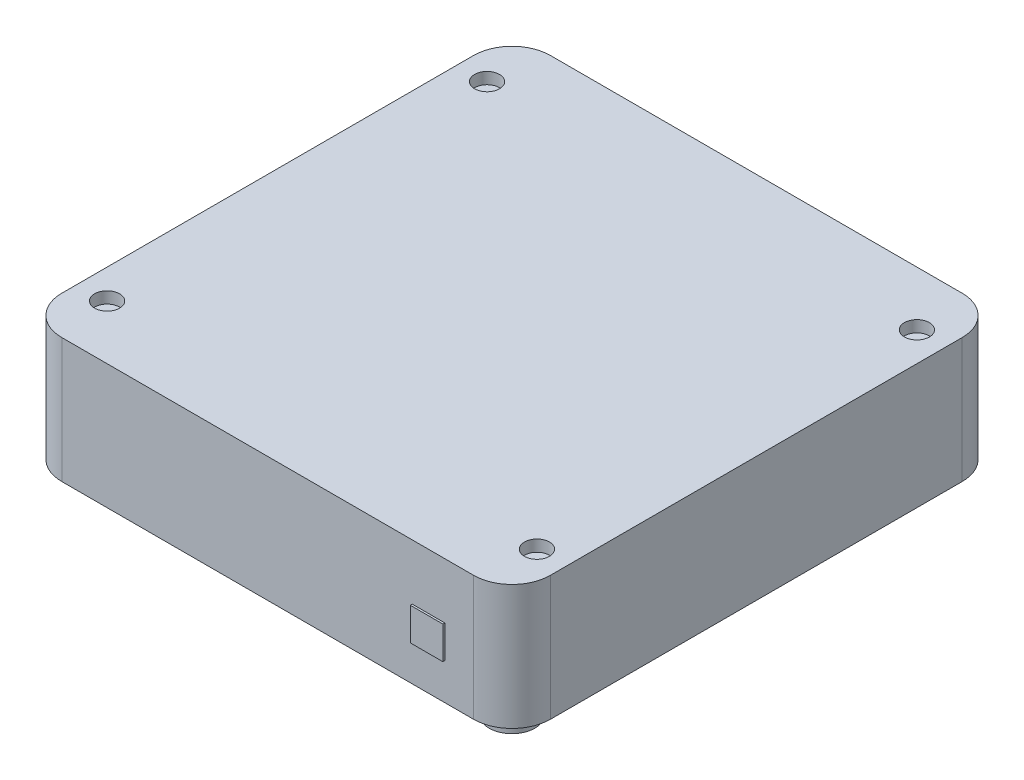
from build123d import *

# Parameters (mm, degrees)
SKETCH_1_W               = 127.3
SKETCH_1_H               = 127.3
EXTRUDE_1_DEPTH          = 16.25
SKETCH_2_W               = 8.5
SKETCH_2_H               = 8.5
EXTRUDE_2_DEPTH          = 0.5
SKETCH_3_R               = 6
EXTRUDE_3_DEPTH          = 6
MIRROR_2_COPY_1_SKETCH_R = 6
MIRROR_2_COPY_1_DEPTH    = 6
SKETCH_4_R               = 3.25
CUT_EXTRUDE_1_DEPTH      = 3
MIRROR_4_COPY_1_SKETCH_R = 3.25
MIRROR_4_COPY_1_DEPTH    = 3
FILLET_1_R               = 10
SKETCH_5_R               = 1.6
CUT_EXTRUDE_2_DEPTH      = 3


with BuildPart() as part:
    # 草图1 → 凸台-拉伸1 (new, symmetric)
    with BuildSketch(Plane(origin=(0, 0, 0), x_dir=(1, 0, 0), z_dir=(0, 1, 0))):
        Rectangle(SKETCH_1_W, SKETCH_1_H)
    extrude(amount=EXTRUDE_1_DEPTH, both=True)

    # 草图2 → 凸台-拉伸2 (add, symmetric)
    with BuildSketch(Plane.XY.offset(63.65)):
        with Locations((41.9, -2.5)):
            Rectangle(SKETCH_2_W, SKETCH_2_H)
    extrude(amount=EXTRUDE_2_DEPTH, both=True)

    # 草图3 → 凸台-拉伸3 (add)
    with BuildSketch(Plane.XZ.offset(16.25)):
        with Locations(Location((51.65, 51.65, 0), (0, 0, 90))):
            Circle(SKETCH_3_R)
    extrude_3 = extrude(amount=EXTRUDE_3_DEPTH)

    # 镜向1: 凸台-拉伸3 across plane
    add(extrude_3.mirror(Plane.XY))

    # 镜向2: 凸台-拉伸3 across plane
    add(extrude_3.mirror(Plane(origin=(0, 0, 0), x_dir=(0, 0, 1), z_dir=(1, 0, 0))))

    # 镜向2 copy 1 sketch → 镜向2 copy 1 (add)
    with BuildSketch(Plane(origin=(0, -16.25, 0), x_dir=(-1, 0, 0), z_dir=(0, -1, 0))):
        with Locations(Location((51.65, 51.65, 0), (0, 0, 90))):
            Circle(MIRROR_2_COPY_1_SKETCH_R)
    extrude(amount=MIRROR_2_COPY_1_DEPTH)

    # 草图4 → 切除-拉伸1 (cut)
    with BuildSketch(Plane(origin=(0, 16.25, 0), x_dir=(1, 0, 0), z_dir=(0, 1, 0))):
        with Locations(Location((56, 49.5, 0), (0, 0, 270))):
            Circle(SKETCH_4_R)
    cut_extrude_1 = extrude(amount=-CUT_EXTRUDE_1_DEPTH, mode=Mode.SUBTRACT)

    # 镜向3: 切除-拉伸1 across plane
    add(cut_extrude_1.mirror(Plane(origin=(0, 0, 0), x_dir=(0, 0, 1), z_dir=(1, 0, 0))), mode=Mode.SUBTRACT)

    # 镜向4: 切除-拉伸1 across plane
    add(cut_extrude_1.mirror(Plane.XY), mode=Mode.SUBTRACT)

    # 镜向4 copy 1 sketch → 镜向4 copy 1 (cut)
    with BuildSketch(Plane(origin=(0, 16.25, 0), x_dir=(-1, 0, 0), z_dir=(0, 1, 0))):
        with Locations(Location((56, 49.5, 0), (0, 0, 270))):
            Circle(MIRROR_4_COPY_1_SKETCH_R)
    extrude(amount=-MIRROR_4_COPY_1_DEPTH, mode=Mode.SUBTRACT)

    # 圆角1
    fillet_1_edges = [part.edges().sort_by_distance(p)[0] for p in [
        (63.65, 0, 63.65),
        (-63.65, 0, 63.65),
        (-63.65, 0, -63.65),
        (63.65, 0, -63.65),
    ]]
    fillet(fillet_1_edges, radius=FILLET_1_R)

    # 草图5 → 切除-拉伸2 (cut)
    with BuildSketch(Plane.XZ.offset(16.25)):
        with Locations(Location((-48, 0, 0), (0, 0, 270))):
            Circle(SKETCH_5_R)
        with Locations(Location((48, 0, 0), (0, 0, 270))):
            Circle(SKETCH_5_R)
    extrude(amount=-CUT_EXTRUDE_2_DEPTH, mode=Mode.SUBTRACT)


solid = part.part
